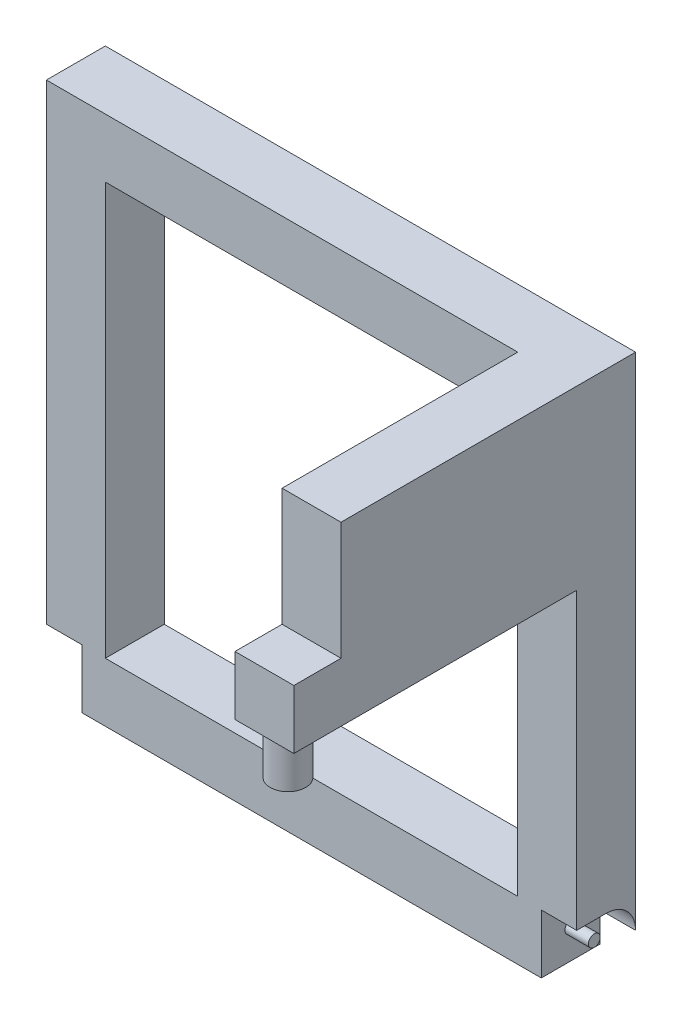
from build123d import *

# Parameters (mm, degrees)
SKETCH_1_W          = 45
SKETCH_1_H          = 45
SKETCH_1_W_2        = 35
SKETCH_1_H_2        = 35
EXTRUDE_1_DEPTH     = 5
CUT_EXTRUDE_1_DEPTH = 3
SKETCH_3_R          = 0.5
EXTRUDE_2_DEPTH     = 2
SKETCH_4_W          = 5
SKETCH_4_H          = 15
EXTRUDE_3_DEPTH     = 20
SKETCH_5_W          = 5
SKETCH_5_H          = 5
EXTRUDE_4_DEPTH     = 4
SKETCH_6_R          = 1.5
EXTRUDE_5_DEPTH     = 4


with BuildPart() as part:
    # 草圖1 → 填料-伸長1 (new body)
    with BuildSketch(Plane.XY):
        Rectangle(SKETCH_1_W, SKETCH_1_H)
        Rectangle(SKETCH_1_W_2, SKETCH_1_H_2, mode=Mode.SUBTRACT)
    extrude(amount=EXTRUDE_1_DEPTH)

    # 草圖2 → 除料-伸長1 (cut)
    with BuildSketch(Plane.ZY.offset(22.5)):
        with BuildLine():
            Line((2.5, -17.5), (5, -17.5))
            Line((5, -17.5), (5, -22.5))
            Line((5, -22.5), (0, -22.5))
            Line((0, -22.5), (0, -20))
            ThreePointArc((0, -20), (0.732233047, -18.232233047), (2.5, -17.5))
        make_face()
    cut_extrude_1 = extrude(amount=-CUT_EXTRUDE_1_DEPTH, mode=Mode.SUBTRACT)

    # 鏡射1: 除料-伸長1 across plane
    add(cut_extrude_1.mirror(Plane(origin=(0, 0, 0), x_dir=(0, 0, 1), z_dir=(1, 0, 0))), mode=Mode.SUBTRACT)

    # 草圖3 → 填料-伸長2 (add)
    with BuildSketch(Plane.ZY.offset(19.5)):
        with Locations(Location((2.5, -20, 0), (0, 0, 270))):
            Circle(SKETCH_3_R)
    extrude_2 = extrude(amount=EXTRUDE_2_DEPTH)

    # 鏡射2: 填料-伸長2 across plane
    add(extrude_2.mirror(Plane(origin=(0, 0, 0), x_dir=(0, 0, 1), z_dir=(1, 0, 0))))

    # 草圖4 → 填料-伸長3 (add)
    with BuildSketch(Plane.XY.offset(5)):
        with Locations((20, 15)):
            Rectangle(SKETCH_4_W, SKETCH_4_H)
    extrude(amount=EXTRUDE_3_DEPTH)

    # 草圖5 → 填料-伸長4 (add)
    with BuildSketch(Plane.XY.offset(25)):
        with Locations((20, 10)):
            Rectangle(SKETCH_5_W, SKETCH_5_H)
    extrude(amount=EXTRUDE_4_DEPTH)

    # 草圖6 → 填料-伸長5 (add)
    with BuildSketch(Plane.XZ.offset(-7.5)):
        with Locations(Location((20, 27, 0), (0, 0, 90))):
            Circle(SKETCH_6_R)
    extrude(amount=EXTRUDE_5_DEPTH)


solid = part.part
